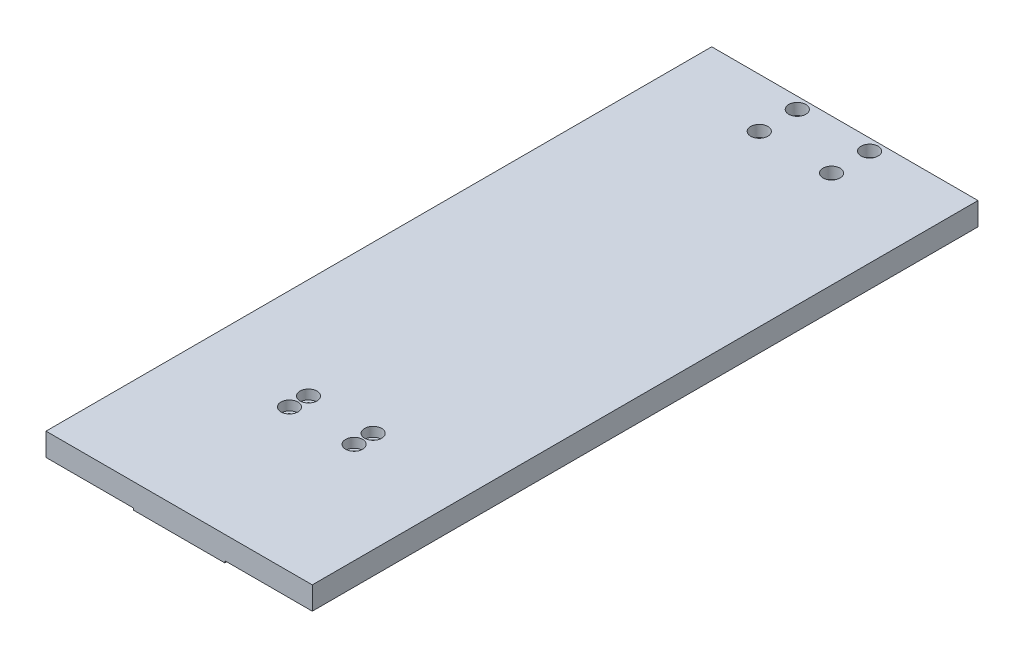
from build123d import *

# Parameters (mm, degrees)
SZKIC1_W                                             = 140
SZKIC1_H                                             = 350
DODANIE_WYCI_GNI_CIE1_DEPTH                          = 13
SZKIC2_W                                             = 46
SZKIC2_H                                             = 350
WYTNIJ_WYCI_GNI_CIE1_DEPTH                           = 1
OTW_R_GWINTOWANY_M5X0_81_D                           = 4.2
OTW_R_GWINTOWANY_M5X0_81_DEPTH                       = 35
OTW_R_GWINTOWANY_M5X0_81_TIP                         = 1.2618073
SZKIC12_W                                            = 48
SZKIC12_H                                            = 40
WYTNIJ_WYCI_GNI_CIE3_DEPTH                           = 1
POG_BIENIE_WALCOWE_POD_M5_WKR_T_DO_CZ_CI_D           = 5.5
POG_BIENIE_WALCOWE_POD_M5_WKR_T_DO_CZ_CI_CBORE_D     = 9
POG_BIENIE_WALCOWE_POD_M5_WKR_T_DO_CZ_CI_CBORE_DEPTH = 6
POG_BIENIE_WALCOWE_POD_M5_WKR_T_DO_C_2_D             = 5.5
POG_BIENIE_WALCOWE_POD_M5_WKR_T_DO_C_2_CBORE_D       = 9
POG_BIENIE_WALCOWE_POD_M5_WKR_T_DO_C_2_CBORE_DEPTH   = 5


with BuildPart() as part:
    # Szkic1 → Dodanie-wyciągnięcie1 (new body)
    with BuildSketch(Plane(origin=(0, 0, 0), x_dir=(1, 0, 0), z_dir=(0, 1, 0))):
        with Locations((70, 175)):
            Rectangle(SZKIC1_W, SZKIC1_H)
    extrude(amount=DODANIE_WYCI_GNI_CIE1_DEPTH)

    # Szkic2 → Wytnij-wyciągnięcie1 (cut)
    with BuildSketch(Plane.XZ):
        with Locations((23, -175)):
            Rectangle(SZKIC2_W, SZKIC2_H)
        with Locations((117, -175)):
            Rectangle(SZKIC2_W, SZKIC2_H)
    extrude(amount=-WYTNIJ_WYCI_GNI_CIE1_DEPTH, mode=Mode.SUBTRACT)

    # Otwór gwintowany M5x0.81
    with Locations(Plane(origin=(0, 0, -350), x_dir=(-1, 0, 0), z_dir=(0, 0, -1))):
        with Locations((-130, 7), (-105, 7), (-35, 7), (-10, 7)):
            Hole(OTW_R_GWINTOWANY_M5X0_81_D / 2, depth=OTW_R_GWINTOWANY_M5X0_81_DEPTH)
            with Locations((0, 0, -(OTW_R_GWINTOWANY_M5X0_81_DEPTH + OTW_R_GWINTOWANY_M5X0_81_TIP / 2))):  # 118° drill point
                Cone(0, OTW_R_GWINTOWANY_M5X0_81_D / 2, OTW_R_GWINTOWANY_M5X0_81_TIP, mode=Mode.SUBTRACT)

    # Szkic12 → Wytnij-wyciągnięcie3 (cut)
    with BuildSketch(Plane(origin=(0, 0, 0), x_dir=(-1, 0, 0), z_dir=(0, -1, 0))):
        with Locations((-70, 80)):
            Rectangle(SZKIC12_W, SZKIC12_H)
        with Locations((-70, 330)):
            Rectangle(SZKIC12_W, SZKIC12_H)
    extrude(amount=-WYTNIJ_WYCI_GNI_CIE3_DEPTH, mode=Mode.SUBTRACT)

    # Pog_bienie walcowe pod M5 Wkr_t do cz_ci (through all)
    with Locations(Plane(origin=(0, 13, 0), x_dir=(1, 0, 0), z_dir=(0, 1, 0))):
        with Locations((51, 344), (89, 344), (51, 324), (89, 324)):
            CounterBoreHole(POG_BIENIE_WALCOWE_POD_M5_WKR_T_DO_CZ_CI_D / 2, POG_BIENIE_WALCOWE_POD_M5_WKR_T_DO_CZ_CI_CBORE_D / 2, POG_BIENIE_WALCOWE_POD_M5_WKR_T_DO_CZ_CI_CBORE_DEPTH)

    # Pog_bienie walcowe pod M5 Wkr_t do c 2 (through all)
    with Locations(Plane(origin=(0, 13, 0), x_dir=(1, 0, 0), z_dir=(0, 1, 0))):
        with Locations((53, 85), (87, 85), (53, 75), (87, 75)):
            CounterBoreHole(POG_BIENIE_WALCOWE_POD_M5_WKR_T_DO_C_2_D / 2, POG_BIENIE_WALCOWE_POD_M5_WKR_T_DO_C_2_CBORE_D / 2, POG_BIENIE_WALCOWE_POD_M5_WKR_T_DO_C_2_CBORE_DEPTH)


solid = part.part
